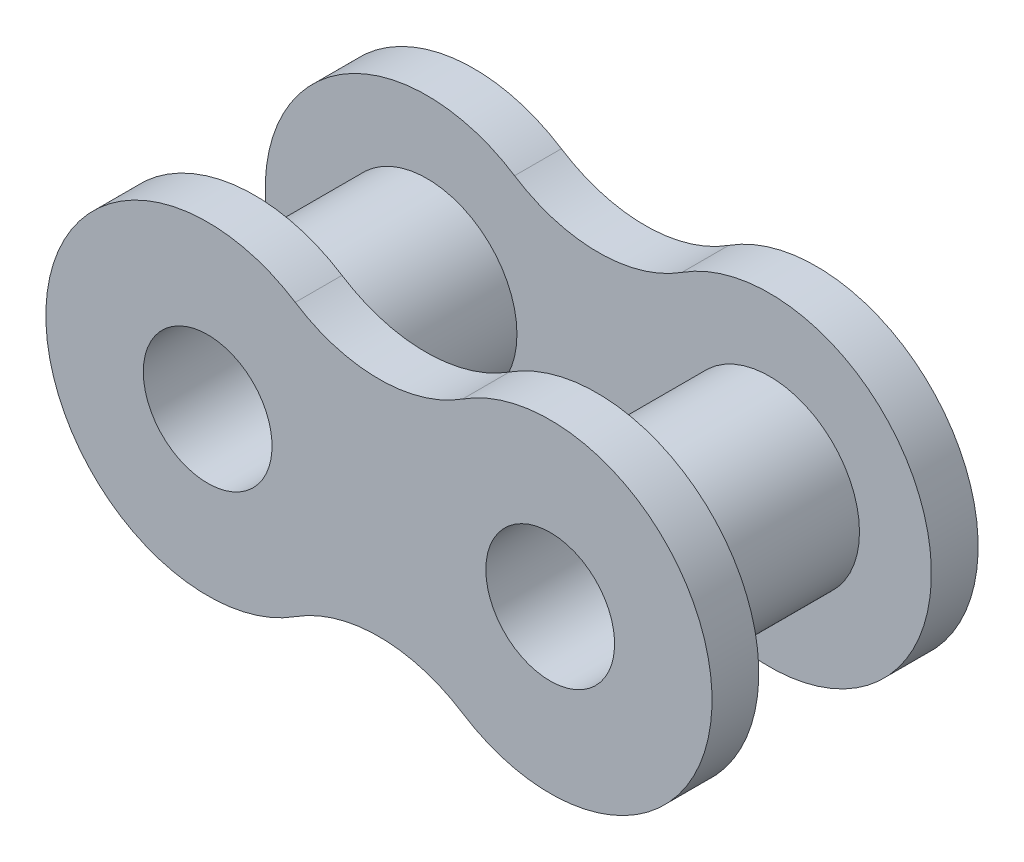
from build123d import *

# Parameters (mm, degrees)
BOSS_EXTRUDE1_DEPTH     = 1.3
SKETCH2_R               = 2.5
SKETCH2_R_2             = 1.79
BOSS_EXTRUDE2_DEPTH     = 5
CUT_EXTRUDE1_DEPTH      = 11.942298947
CUT_EXTRUDE1_DEPTH_BACK = 11.942298947
SKETCH4_R               = 1.79


with BuildPart() as part:
    # Sketch1 → Boss-Extrude1 (new body)
    with BuildSketch(Plane.XY):
        with BuildLine():
            ThreePointArc((-2.327269665, 3.784131765), (-9.2625, 0), (-2.327269665, -3.784131765))
            ThreePointArc((-2.327269665, -3.784131765), (0, -3.1), (2.327269665, -3.784131765))
            ThreePointArc((2.327269665, -3.784131765), (9.2625, 0), (2.327269665, 3.784131765))
            ThreePointArc((2.327269665, 3.784131765), (0, 3.1), (-2.327269665, 3.784131765))
        make_face()
    boss_extrude1 = extrude(amount=BOSS_EXTRUDE1_DEPTH)

    # Sketch2 → Boss-Extrude2 (add)
    # profile 1 of 2: a face of its own
    with BuildSketch(Plane.XY.offset(1.3)):
        with Locations(Location((-4.7625, 0, 0), (0, 0, 180))):
            Circle(SKETCH2_R)
        with Locations((-4.7625, 0)):
            Circle(SKETCH2_R_2, mode=Mode.SUBTRACT)
    # profile 2 of 2: a face of its own
    with BuildSketch(Plane.XY.offset(1.3)):
        with Locations(Location((4.7625, 0, 0), (0, 0, 180))):
            Circle(SKETCH2_R)
        with Locations((4.7625, 0)):
            Circle(SKETCH2_R_2, mode=Mode.SUBTRACT)
    extrude(amount=BOSS_EXTRUDE2_DEPTH)

    # Mirror5: Boss-Extrude1 across plane
    add(boss_extrude1.mirror(Plane(origin=(0, 0, 3.7), x_dir=(1, 0, 0), z_dir=(0, 0, -1))))

    # Sketch4 → Cut-Extrude1 (cut, two sides: drawn at the far end of the back side and taken through both)
    with BuildSketch(Plane(origin=(0, 0, 3.7), x_dir=(-1, 0, 0), z_dir=(0, 0, -1)).offset(-CUT_EXTRUDE1_DEPTH_BACK)):
        with Locations((-4.7625, 0)):
            Circle(SKETCH4_R)
        with Locations((4.7625, 0)):
            Circle(SKETCH4_R)
    extrude(amount=CUT_EXTRUDE1_DEPTH + CUT_EXTRUDE1_DEPTH_BACK, mode=Mode.SUBTRACT)


solid = part.part
